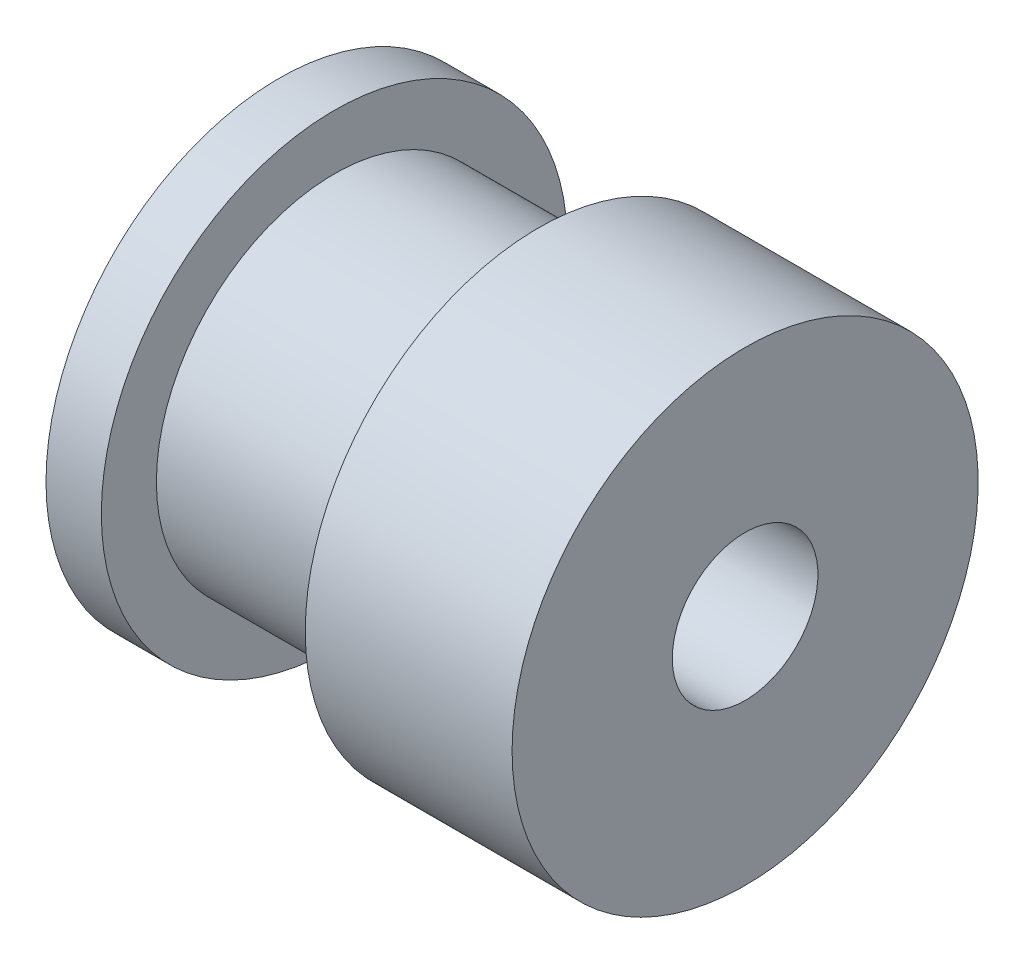
from build123d import *


with BuildPart() as part:
    # Sketch1 → Revolve1 (revolve)
    with BuildSketch(Plane.XY, mode=Mode.PRIVATE) as revolve1_sk:
        Polygon((0, -2.5), (0, -8), (1.9, -8), (1.9, -6.11), (8.9, -6.11), (8.9, -8), (16, -8), (16, -2.5), align=None)
    revolve(revolve1_sk.sketch.rotate(Axis((0, 0, 0), (1, 0, 0)), 270), axis=Axis((0, 0, 0), (1, 0, 0)))


solid = part.part
